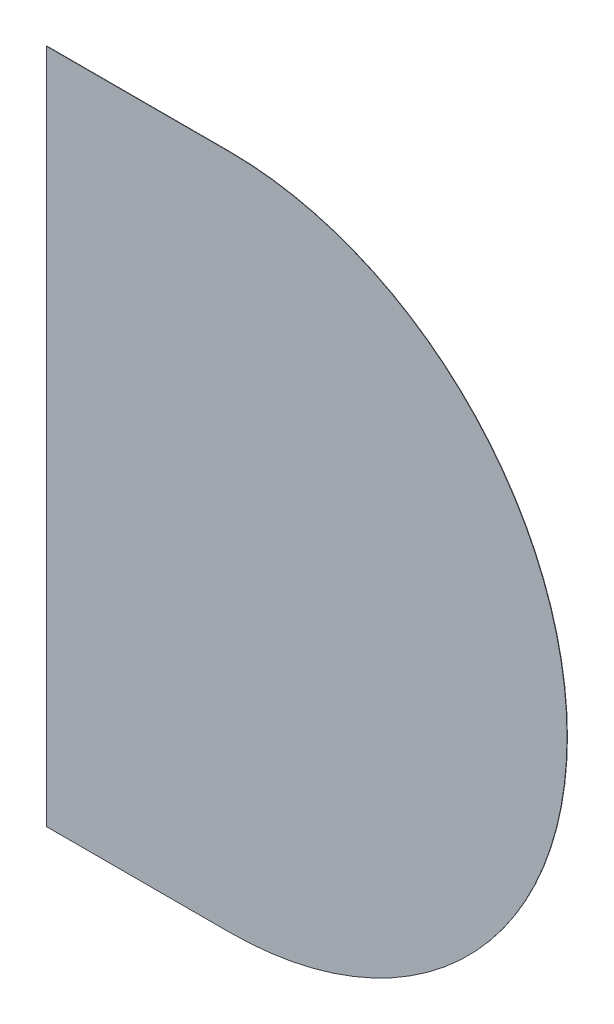
from build123d import *

# Parameters (mm, degrees)
BOSS_EXTRUDE1_DEPTH = 1


with BuildPart() as part:
    # Sketch1 → Boss-Extrude1 (new body)
    with BuildSketch(Plane.XY):
        with BuildLine():
            Line((0, 0), (470, 0))
            ThreePointArc((470, 0), (1340, 870), (470, 1740))
            Line((470, 1740), (0, 1740))
            Line((0, 1740), (0, 0))
        make_face()
    extrude(amount=BOSS_EXTRUDE1_DEPTH)


solid = part.part
